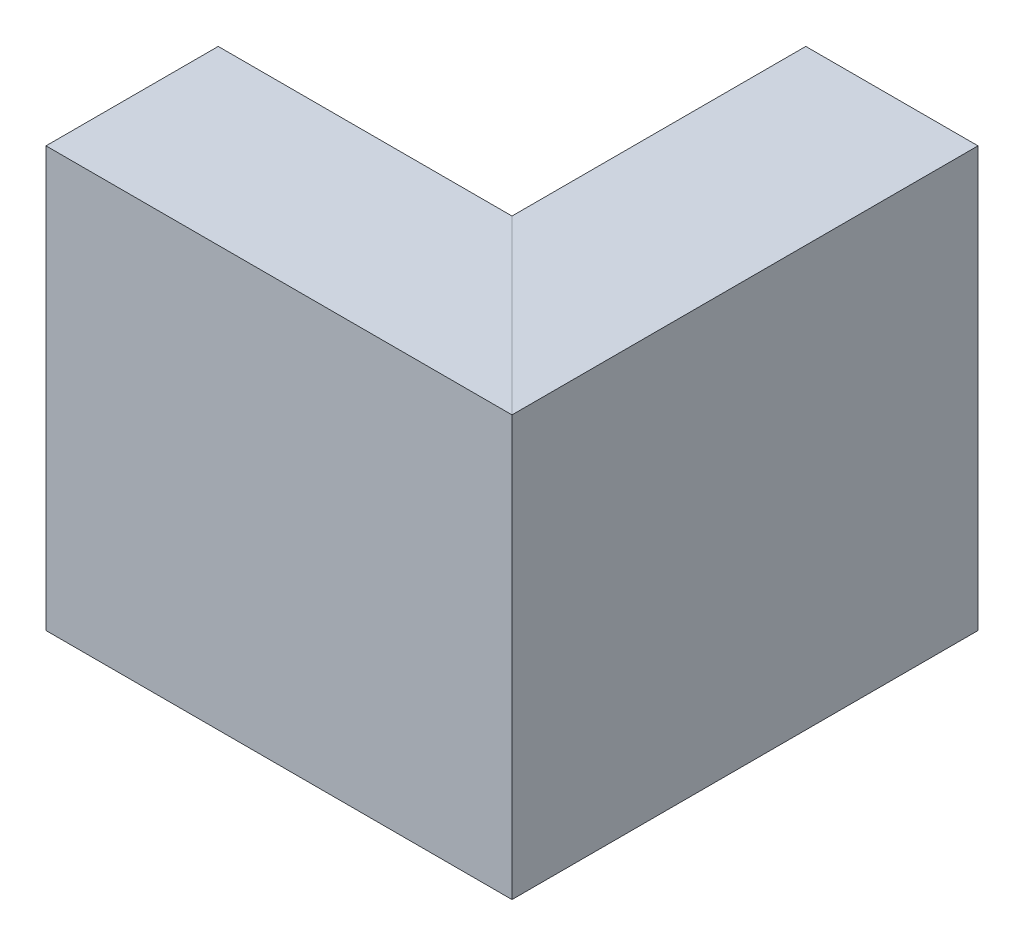
from build123d import *

# Parameters (mm, degrees)
SKETCH3_W          = 4.037166667
SKETCH3_H          = 4.037166667
CUT_EXTRUDE1_DEPTH = 38.455371645


with BuildPart() as part:
    # Sweep1: sweep along a path in Sketch2
    with BuildLine(Plane(origin=(0, 0, 0), x_dir=(1, 0, 0), z_dir=(0, 1, 0))) as sweep1_path:
        Line((0, 0), (0, -19.05))
        Line((0, -19.05), (-19.05, -19.05))
    # Sketch1 → Sweep1 (sweep)
    with BuildSketch(Plane.XY):
        Polygon((2.31775, -19.05), (4.31775, -19.05), (4.31775, 2), (-4.31775, 2), (-3.18725, -22.225), (-1.280583333, -22.225), (-2.31775, 0), (2.31775, 0), align=None)
    sweep(path=sweep1_path.line, transition=Transition.RIGHT)

    # Sketch3 → Cut-Extrude1 (cut, through all)
    with BuildSketch(Plane.XZ):
        with Locations((-3.299166667, 15.750833334)):
            Rectangle(SKETCH3_W, SKETCH3_H)
    extrude(amount=CUT_EXTRUDE1_DEPTH, mode=Mode.SUBTRACT)


solid = part.part
